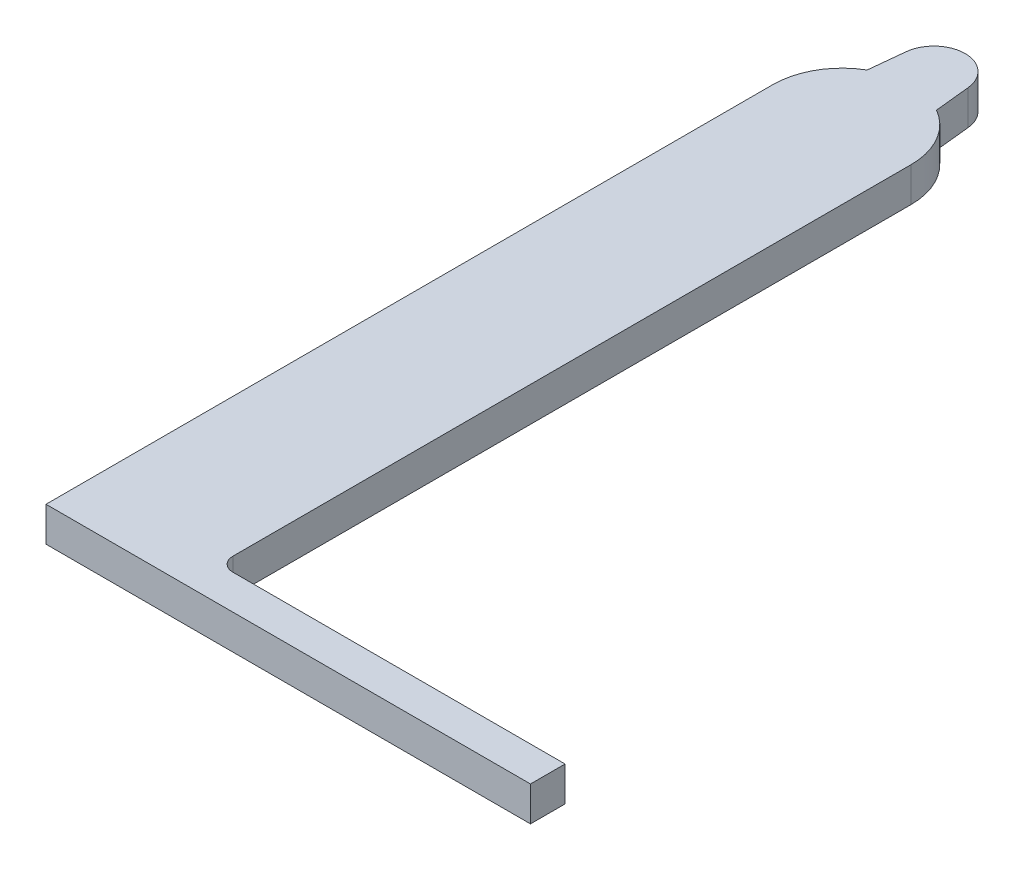
from build123d import *

# Parameters (mm, degrees)
BOSS_EXTRUDE1_DEPTH = 6.35
SKETCH2_W           = 88.9
SKETCH2_H           = 6.35
BOSS_EXTRUDE2_DEPTH = 6.35
FILLET1_R           = 2.54
BOSS_EXTRUDE3_DEPTH = 6.35


with BuildPart() as part:
    # Sketch1 → Boss-Extrude1 (new body)
    with BuildSketch(Plane(origin=(0, 0, 0), x_dir=(1, 0, 0), z_dir=(0, 1, 0))):
        with BuildLine():
            ThreePointArc((12.7, 0), (0, -12.7), (-12.7, 0))
            Line((-12.7, 0), (-12.7, -127))
            Line((-12.7, -127), (12.7, -127))
            Line((12.7, -127), (12.7, 0))
        make_face()
        with BuildLine():
            ThreePointArc((12.7, 0), (0, 12.7), (-12.7, 0))
            Line((-12.7, 0), (12.7, 0))
        make_face()
        with BuildLine():
            Line((12.7, 0), (-12.7, 0))
            ThreePointArc((-12.7, 0), (0, -12.7), (12.7, 0))
        make_face()
    extrude(amount=BOSS_EXTRUDE1_DEPTH)

    # Sketch2 → Boss-Extrude2 (add)
    with BuildSketch(Plane(origin=(0, 6.35, 0), x_dir=(1, 0, 0), z_dir=(0, 1, 0))):
        with Locations((31.75, -130.175)):
            Rectangle(SKETCH2_W, SKETCH2_H)
    extrude(amount=-BOSS_EXTRUDE2_DEPTH)

    # Fillet1
    fillet1_edges = [part.edges().sort_by_distance(p)[0] for p in [
        (12.7, 3.175, 127),
    ]]
    fillet(fillet1_edges, radius=FILLET1_R)

    # Sketch3 → Boss-Extrude3 (add)
    with BuildSketch(Plane(origin=(0, 0, 0), x_dir=(-1, 0, 0), z_dir=(0, -1, 0))):
        with BuildLine():
            Line((-7.384124229, 1.213847931), (7.384124229, 1.213847931))
            Line((7.384124229, 1.213847931), (5.698055631, 17.468424552))
            ThreePointArc((5.698055631, 17.468424552), (0, 22.606), (-5.698055631, 17.468424552))
            Line((-5.698055631, 17.468424552), (-7.384124229, 1.213847931))
        make_face()
    extrude(amount=-BOSS_EXTRUDE3_DEPTH)


solid = part.part
